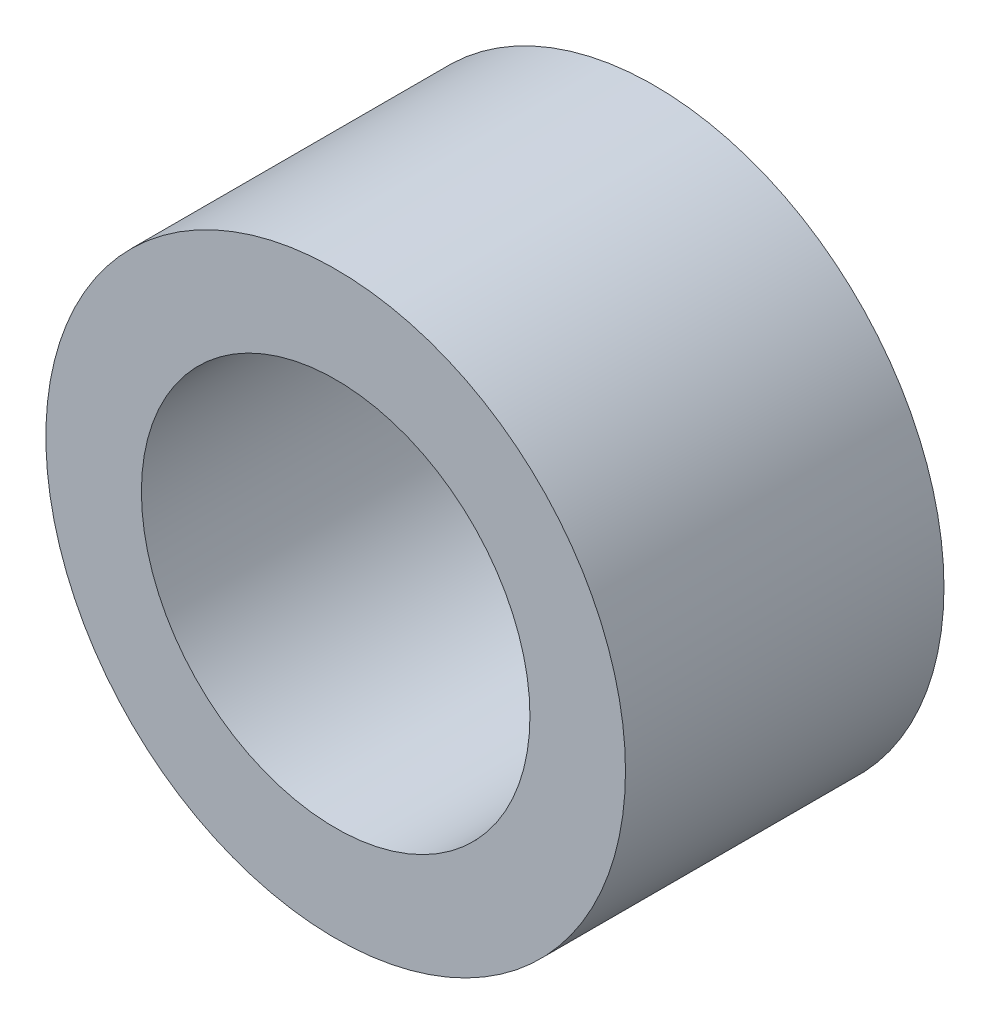
from build123d import *

# Parameters (mm, degrees)
CROQUIS1_R              = 9.1
CROQUIS1_R_2            = 6.1
SALIENTE_EXTRUIR1_DEPTH = 10


with BuildPart() as part:
    # Croquis1 → Saliente-Extruir1 (new body)
    with BuildSketch(Plane.XY):
        Circle(CROQUIS1_R)
        Circle(CROQUIS1_R_2, mode=Mode.SUBTRACT)
    extrude(amount=SALIENTE_EXTRUIR1_DEPTH)


solid = part.part
